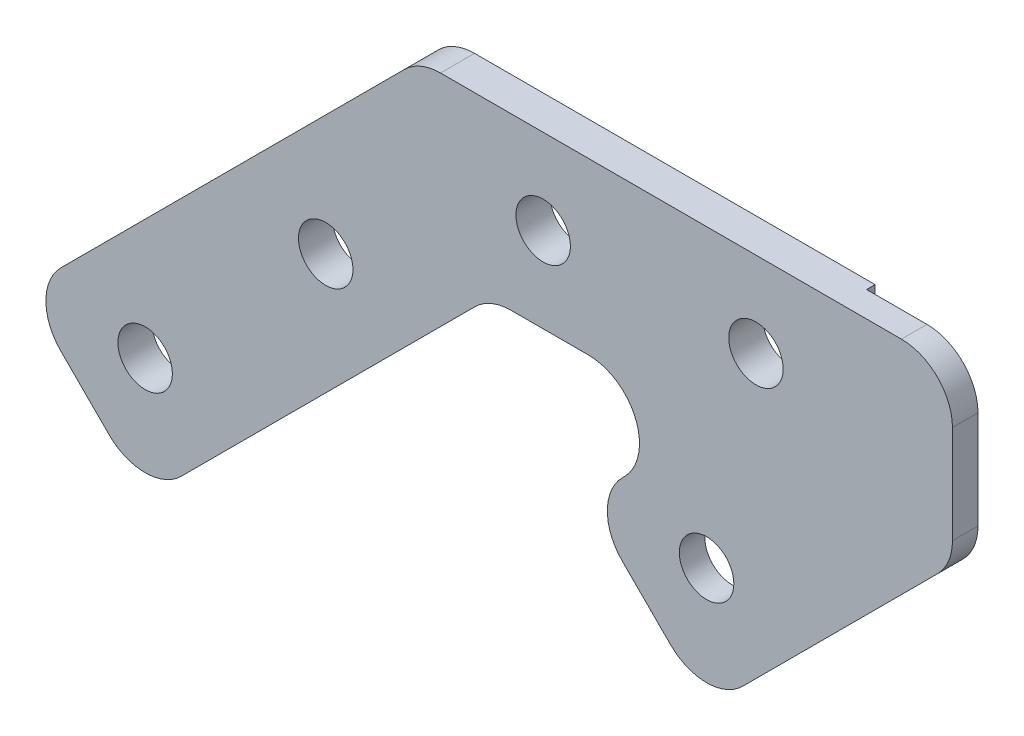
from build123d import *

# Parameters (mm, degrees)
SKETCH_1_R      = 1.6
EXTRUDE_1_DEPTH = 2
SKETCH_3_R      = 1.6
EXTRUDE_2_DEPTH = 1.5
FILLET_2_R      = 3


with BuildPart() as part:
    # ｽｹｯﾁ1 → ﾎﾞｽ - 押し出し1 (new body)
    with BuildSketch(Plane.XY):
        Polygon((-27.32233047, -13.180194847), (-20.251262658, -20.251262658), (0, 0), (20.628932188, 0), (20.628932188, 10), (-4.142135624, 10), align=None)
        with Locations((3.128932188, 5)):
            Circle(SKETCH_1_R, mode=Mode.SUBTRACT)
        with Locations((15.628932188, 5)):
            Circle(SKETCH_1_R, mode=Mode.SUBTRACT)
        with Locations((-20.251262658, -13.180194847)):
            Circle(SKETCH_1_R, mode=Mode.SUBTRACT)
        with Locations((-9.644660941, -2.573593129)):
            Circle(SKETCH_1_R, mode=Mode.SUBTRACT)
    extrude(amount=EXTRUDE_1_DEPTH)

    # ｽｹｯﾁ3 → ﾎﾞｽ - 押し出し2 (add)
    with BuildSketch(Plane.XY.offset(2)):
        Polygon((13.028932188, 0), (5.656349186, -7.372583002), (12.727416998, -14.443650814), (27.171067812, 0), (27.171067812, 10), (20.628932188, 10), (20.628932188, 0), align=None)
        with Locations((12.727416998, -7.372583002)):
            Circle(SKETCH_3_R, mode=Mode.SUBTRACT)
    extrude(amount=-EXTRUDE_2_DEPTH)

    # ﾌｨﾚｯﾄ2
    fillet_2_edges = [part.edges().sort_by_distance(p)[0] for p in [
        (-4.142135624, 10, 1),
        (0, 0, 1),
        (-20.251262658, -20.251262658, 1),
        (-27.32233047, -13.180194847, 1),
        (27.171067812, 10, 1.25),
        (27.171067812, 0, 1.25),
        (12.727416998, -14.443650814, 1.25),
        (5.656349186, -7.372583002, 1.25),
        (13.028932188, 0, 1.25),
    ]]
    fillet(fillet_2_edges, radius=FILLET_2_R)


solid = part.part
